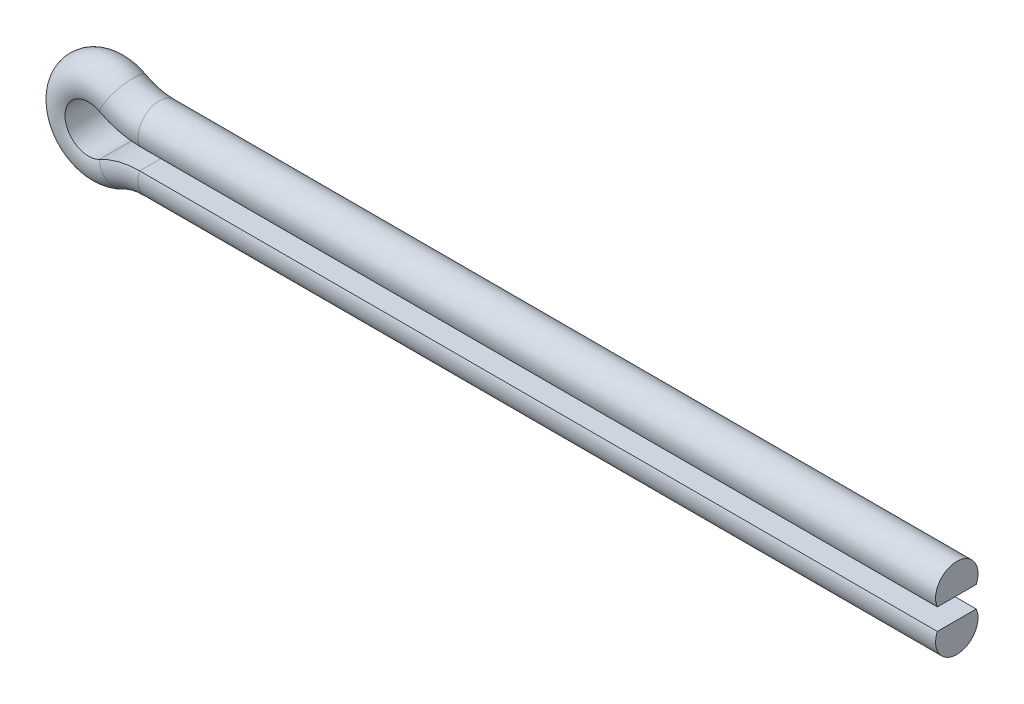
from build123d import *


with BuildPart() as part:
    # Sweep1: sweep along a path in Sketch1
    with BuildLine(Plane.XY) as sweep1_path:
        Line((100, 1.25), (6.031094843, 1.25))
        ThreePointArc((6.031094843, 1.25), (3.595313767, 1.551187158), (1.306257886, 2.43660589))
        ThreePointArc((1.306257886, 2.43660589), (-2.764662354, 0), (1.306257886, -2.43660589))
        ThreePointArc((1.306257886, -2.43660589), (3.595313767, -1.551187158), (6.031094843, -1.25))
        Line((6.031094843, -1.25), (100, -1.25))
    # Sketch2 → Sweep1 (sweep)
    with BuildSketch(Plane(origin=(100, 1.25, 0), x_dir=(0, 0, -1), z_dir=(1, 0, 0))):
        with BuildLine():
            Line((-2.291287847, 0.000119839), (2.291287847, 0.000119839))
            ThreePointArc((2.291287847, 0.000119839), (0, 3.500119839), (-2.291287847, 0.000119839))
        make_face()
    sweep(path=sweep1_path.line)


solid = part.part
